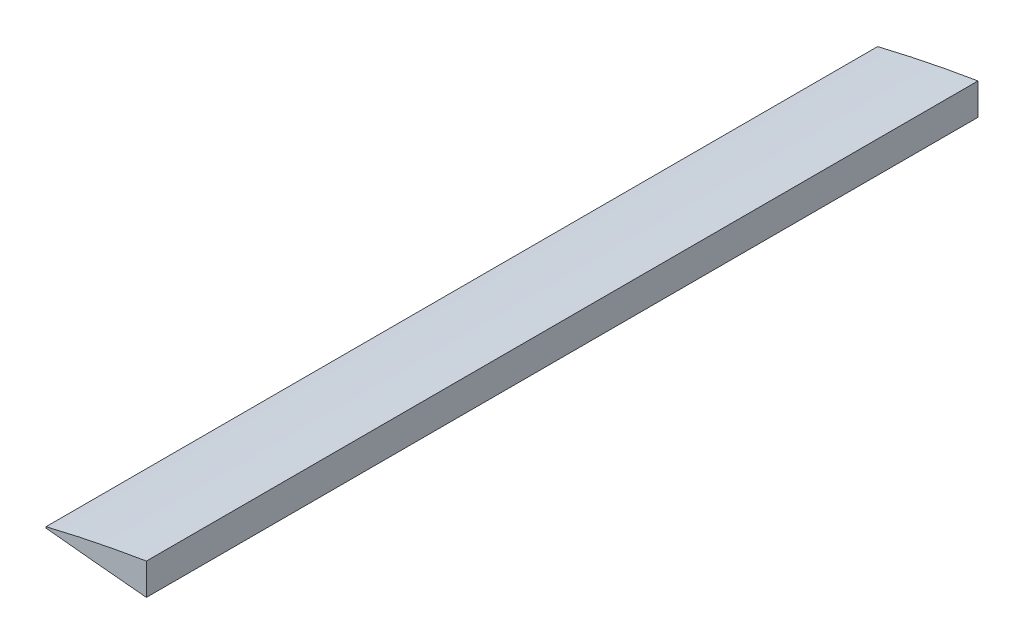
from build123d import *

# Parameters (mm, degrees)
BOSS_EXTRUDE1_DEPTH = 612
SKETCH2_W           = 21
SKETCH2_H           = 11.5
CUT_EXTRUDE1_DEPTH  = 13


with BuildPart() as part:
    # Sketch1 → Boss-Extrude1 (new body)
    with BuildSketch(Plane.XY):
        with BuildLine():
            Line((-210.29024, 15.505831452), (-210.29024, -7.684831645))
            add(Edge.make_bspline(
                [(-210.29024, -7.684831645), (-212.158655952, -7.515448816), (-217.124973789, -7.06522307), (-225.019553341, -6.331687852), (-233.787735511, -5.505727752), (-241.996045088, -4.71925279), (-249.592304467, -3.9801145), (-256.527861272, -3.294770041), (-262.758082866, -2.670079607), (-268.242600772, -2.111780802), (-272.945834406, -1.628193193), (-276.836698489, -1.219072841), (-279.890503934, -0.906023666), (-282.084971372, -0.653321358), (-283.409976301, -0.546659805), (-284.007600869, -0.445986487), (-284.166073983, -0.446550556), (-284.176, -0.446585887)],
                knots=[0, 0, 0, 0, 0.075810952, 0.201508279, 0.320388141, 0.43169539, 0.534719075, 0.628797147, 0.713321079, 0.787740393, 0.851567051, 0.904379655, 0.945827345, 0.975633259, 0.993597432, 0.999598973, 1, 1, 1, 1], degree=3))
            Line((-284.176, -0.446585887), (-284.176, 0.453857008))
            add(Edge.make_bspline(
                [(-210.29024, 15.505831452), (-212.448163353, 15.147934069), (-217.698820474, 14.277098484), (-225.855056301, 12.82414284), (-234.573859634, 11.204768289), (-242.716368314, 9.619953964), (-250.234652113, 8.096769218), (-257.084001233, 6.657241094), (-263.224123516, 5.323919979), (-268.619097385, 4.11810916), (-273.237578484, 3.059760068), (-277.052897895, 2.166891095), (-280.04316213, 1.455156882), (-282.19127614, 0.937226777), (-283.475130043, 0.62509225), (-284.041595768, 0.4866944), (-284.176, 0.453857008)],
                knots=[0, 0, 0, 0, 0.087007005, 0.211705365, 0.329527113, 0.439740645, 0.541660709, 0.634652346, 0.718134669, 0.791584505, 0.854539888, 0.906603358, 0.947445002, 0.976805146, 0.994496602, 1, 1, 1, 1], degree=3))
        make_face()
    extrude(amount=BOSS_EXTRUDE1_DEPTH)

    # Sketch2 → Cut-Extrude1 (cut)
    with BuildSketch(Plane.XY.offset(83.9)):
        with Locations((-223.132, -2.442)):
            Rectangle(SKETCH2_W, SKETCH2_H)
    extrude(amount=CUT_EXTRUDE1_DEPTH, mode=Mode.SUBTRACT)


solid = part.part
